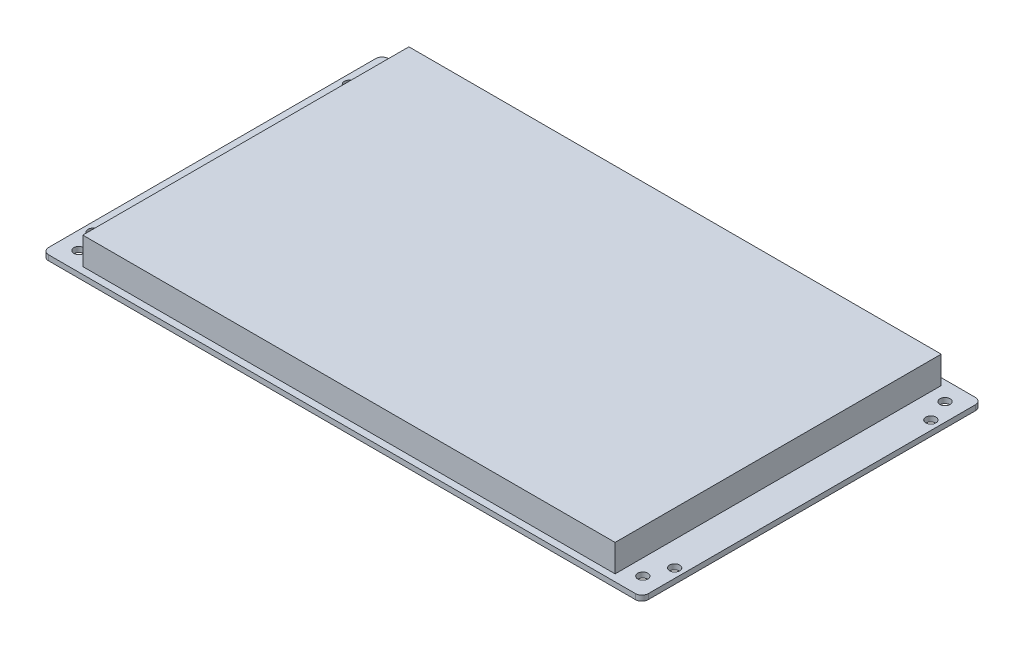
from build123d import *

# Parameters (mm, degrees)
SKETCH1_W      = 187
SKETCH1_H      = 106
EXTRUDE1_DEPTH = 1.64
SKETCH2_W      = 166
SKETCH2_H      = 101.7
EXTRUDE2_DEPTH = 8.5
FILLET1_R      = 2
SKETCH3_R      = 1.575
EXTRUDE3_DEPTH = 8.5


with BuildPart() as part:
    # Sketch1 → Extrude1 (new body)
    with BuildSketch(Plane(origin=(0, 0, 0), x_dir=(1, 0, 0), z_dir=(0, 1, 0))):
        Rectangle(SKETCH1_W, SKETCH1_H)
    extrude(amount=EXTRUDE1_DEPTH)

    # Fillet1
    fillet1_edges = [part.edges().sort_by_distance(p)[0] for p in [
        (-93.5, 0.82, -53),
        (93.5, 0.82, -53),
        (93.5, 0.82, 53),
        (-93.5, 0.82, 53),
    ]]
    fillet(fillet1_edges, radius=FILLET1_R)

    # Sketch3 → Extrude3 (cut)
    with BuildSketch(Plane(origin=(0, 1.64, 0), x_dir=(1, 0, 0), z_dir=(0, 1, 0))):
        with Locations(Location((87.925, 47.125, 0), (0, 0, 270))):
            Circle(SKETCH3_R)
        with Locations(Location((90.675, 39.95, 0), (0, 0, 270))):
            Circle(SKETCH3_R)
        with Locations(Location((90.675, -39.95, 0), (0, 0, 270))):
            Circle(SKETCH3_R)
        with Locations(Location((87.925, -47.125, 0), (0, 0, 270))):
            Circle(SKETCH3_R)
        with Locations(Location((-87.925, -47.125, 0), (0, 0, 270))):
            Circle(SKETCH3_R)
        with Locations(Location((-90.675, -39.95, 0), (0, 0, 270))):
            Circle(SKETCH3_R)
        with Locations(Location((-87.925, 47.125, 0), (0, 0, 270))):
            Circle(SKETCH3_R)
        with Locations(Location((-90.675, 39.95, 0), (0, 0, 270))):
            Circle(SKETCH3_R)
    extrude(amount=-EXTRUDE3_DEPTH, mode=Mode.SUBTRACT)


with BuildPart() as body_2:
    # Sketch2 → Extrude2 (new body)
    with BuildSketch(Plane(origin=(0, 1.64, 0), x_dir=(1, 0, 0), z_dir=(0, 1, 0))):
        Rectangle(SKETCH2_W, SKETCH2_H)
    extrude(amount=EXTRUDE2_DEPTH)


solid = Compound([part.part, body_2.part])
